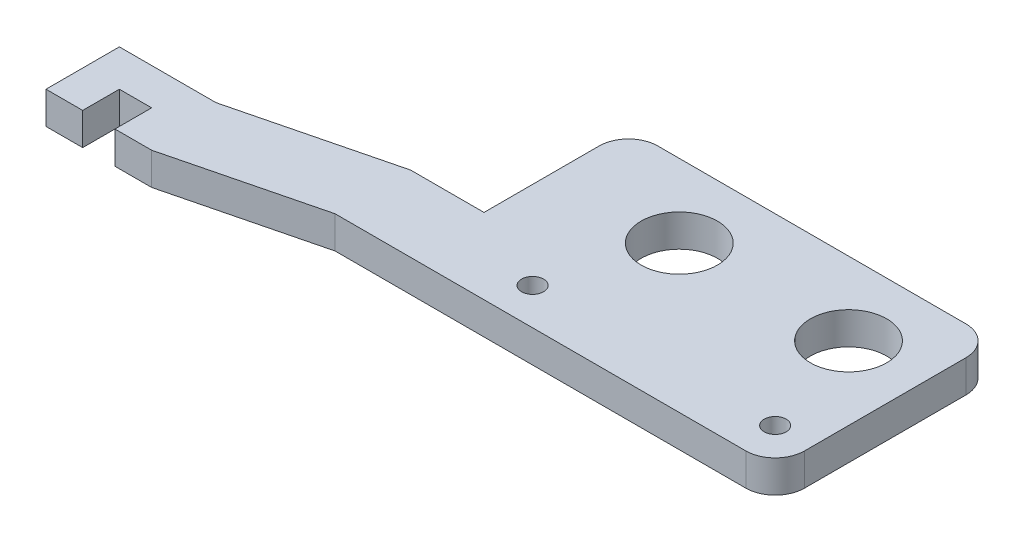
from build123d import *

# Parameters (mm, degrees)
BOSS_EXTRUDE1_DEPTH = 2.794
SKETCH2_R           = 0.9525
SKETCH2_R_2         = 3.302
CUT_EXTRUDE1_DEPTH  = 63.960241994
FILLET2_R           = 2.54


with BuildPart() as part:
    # Sketch1 → Boss-Extrude1 (new body)
    with BuildSketch(Plane(origin=(0, 0, 0), x_dir=(1, 0, 0), z_dir=(0, 1, 0))):
        Polygon((59.944, 0), (21.844, 0), (9.144, -3.175), (5.969, -3.175), (5.969, 0), (3.175, 0), (3.175, -3.175), (0, -3.175), (0, 3.175), (8.362279277, 3.175), (21.844, 6.545430181), (28.194, 6.545430181), (28.194, 19.05), (59.944, 19.05), align=None)
    extrude(amount=BOSS_EXTRUDE1_DEPTH)

    # Sketch2 → Cut-Extrude1 (cut, through all)
    with BuildSketch(Plane(origin=(0, 2.794, 0), x_dir=(1, 0, 0), z_dir=(0, 1, 0))):
        with Locations((56.769, 3.175)):
            Circle(SKETCH2_R)
        with Locations((35.769, 3.175)):
            Circle(SKETCH2_R)
        with Locations((53.594, 12.7)):
            Circle(SKETCH2_R_2)
        with Locations((38.944, 12.7)):
            Circle(SKETCH2_R_2)
    extrude(amount=-CUT_EXTRUDE1_DEPTH, mode=Mode.SUBTRACT)

    # Fillet2
    fillet2_edges = [part.edges().sort_by_distance(p)[0] for p in [
        (59.944, 1.397, 0),
        (59.944, 1.397, -19.05),
        (28.194, 1.397, -19.05),
    ]]
    fillet(fillet2_edges, radius=FILLET2_R)


solid = part.part
